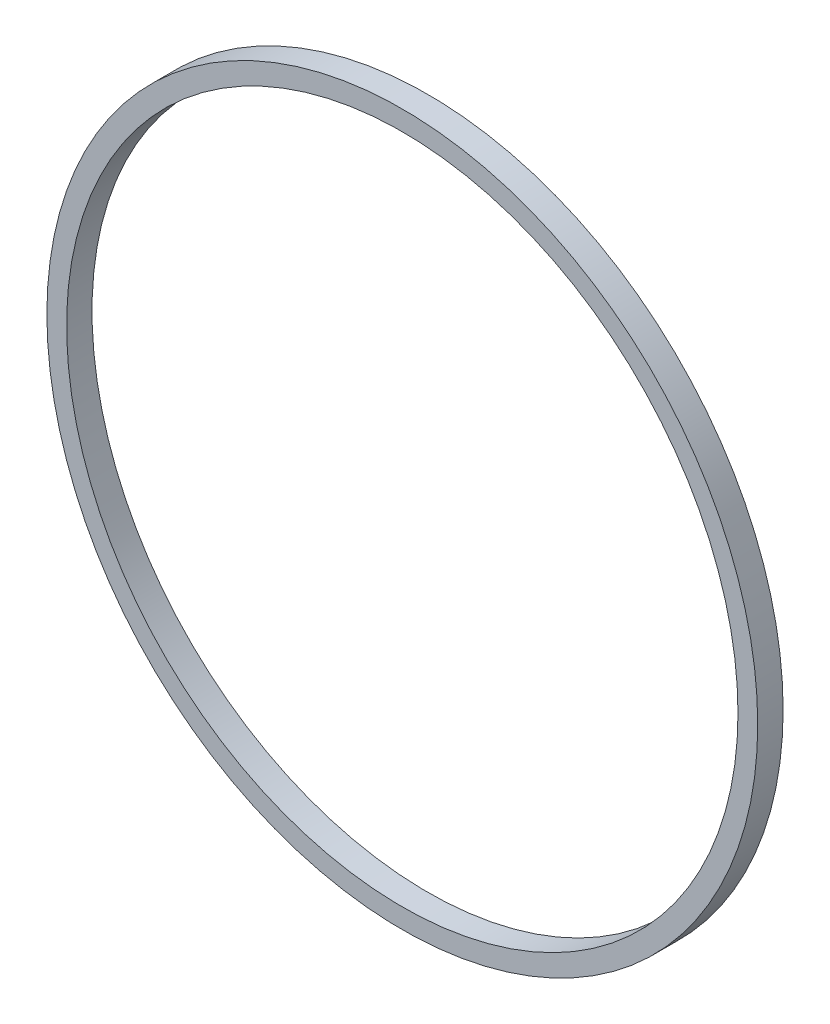
from build123d import *

# Parameters (mm, degrees)
SKETCH1_R           = 63
SKETCH1_R_2         = 59.5
BOSS_EXTRUDE2_DEPTH = 4.5


with BuildPart() as part:
    # Sketch1 → Boss-Extrude2 (new body)
    with BuildSketch(Plane.XY):
        with Locations((70.131179234, 84.268032687)):
            Circle(SKETCH1_R)
        with Locations((70.131179234, 84.268032687)):
            Circle(SKETCH1_R_2, mode=Mode.SUBTRACT)
    extrude(amount=BOSS_EXTRUDE2_DEPTH)


solid = part.part
